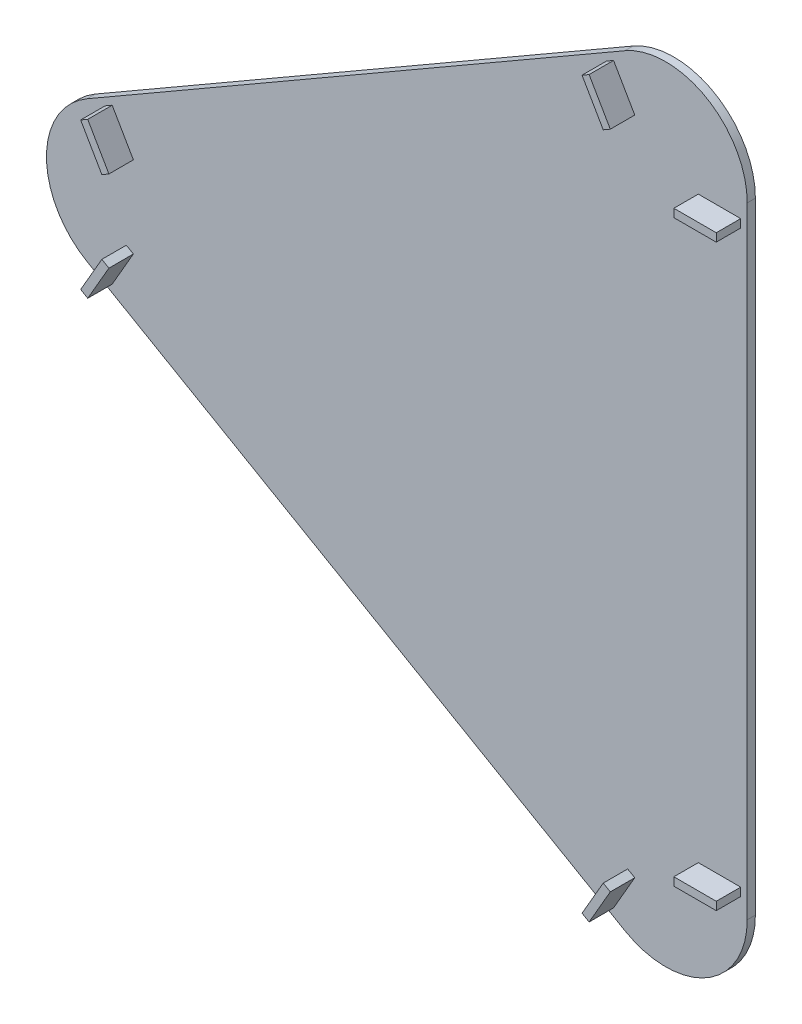
from build123d import *

# Parameters (mm, degrees)
SKETCH1_W           = 26
SKETCH1_H           = 5
BOSS_EXTRUDE1_DEPTH = 5
FILLET1_R           = 50
SKETCH1_5_W         = 26
SKETCH1_5_H         = 5
BOSS_EXTRUDE2_DEPTH = 20


with BuildPart() as part:
    # Sketch1 → Boss-Extrude1 (new body)
    with BuildSketch(Plane.XY):
        Polygon((9.235124147, 168.867198813), (-470.476307556, -108.094325414), (9.235124147, -385.055849641), align=None)
        with Locations((-7.764875853, -285.594325414)):
            Rectangle(SKETCH1_W, SKETCH1_H, mode=Mode.SUBTRACT)
        Polygon((-64.066146043, -308.094325414), (-59.736019024, -310.594325414), (-72.736019024, -333.110985912), (-77.066146043, -330.610985912), align=None, mode=Mode.SUBTRACT)
        Polygon((-371.505164386, -130.594325414), (-367.175037367, -133.094325414), (-380.175037367, -155.610985912), (-384.505164386, -153.110985912), align=None, mode=Mode.SUBTRACT)
        Polygon((-367.175037367, -83.094325414), (-371.505164386, -85.594325414), (-384.505164386, -63.077664915), (-380.175037367, -60.577664915), align=None, mode=Mode.SUBTRACT)
        Polygon((-59.736019024, 94.405674586), (-64.066146043, 91.905674586), (-77.066146043, 114.422335085), (-72.736019024, 116.922335085), align=None, mode=Mode.SUBTRACT)
        with Locations((-7.764875853, 69.405674586)):
            Rectangle(SKETCH1_W, SKETCH1_H, mode=Mode.SUBTRACT)
    extrude(amount=BOSS_EXTRUDE1_DEPTH)

    # Fillet1
    fillet1_edges = [part.edges().sort_by_distance(p)[0] for p in [
        (9.235124147, 168.867198813, 2.5),
        (-470.476307556, -108.094325414, 2.5),
        (9.235124147, -385.055849641, 2.5),
    ]]
    fillet(fillet1_edges, radius=FILLET1_R)

    # Sketch1<5> → Boss-Extrude2 (add)
    with BuildSketch(Plane.XY):
        with Locations((-7.764875853, 69.405674586)):
            Rectangle(SKETCH1_5_W, SKETCH1_5_H)
        with Locations((-7.764875853, -285.594325414)):
            Rectangle(SKETCH1_5_W, SKETCH1_5_H)
        Polygon((-64.066146043, 91.905674586), (-59.736019024, 94.405674586), (-72.736019024, 116.922335085), (-77.066146043, 114.422335085), align=None)
        Polygon((-72.736019024, -333.110985912), (-59.736019024, -310.594325414), (-64.066146043, -308.094325414), (-77.066146043, -330.610985912), align=None)
        Polygon((-371.505164386, -85.594325414), (-367.175037367, -83.094325414), (-380.175037367, -60.577664915), (-384.505164386, -63.077664915), align=None)
        Polygon((-380.175037367, -155.610985912), (-367.175037367, -133.094325414), (-371.505164386, -130.594325414), (-384.505164386, -153.110985912), align=None)
    extrude(amount=BOSS_EXTRUDE2_DEPTH)


solid = part.part
